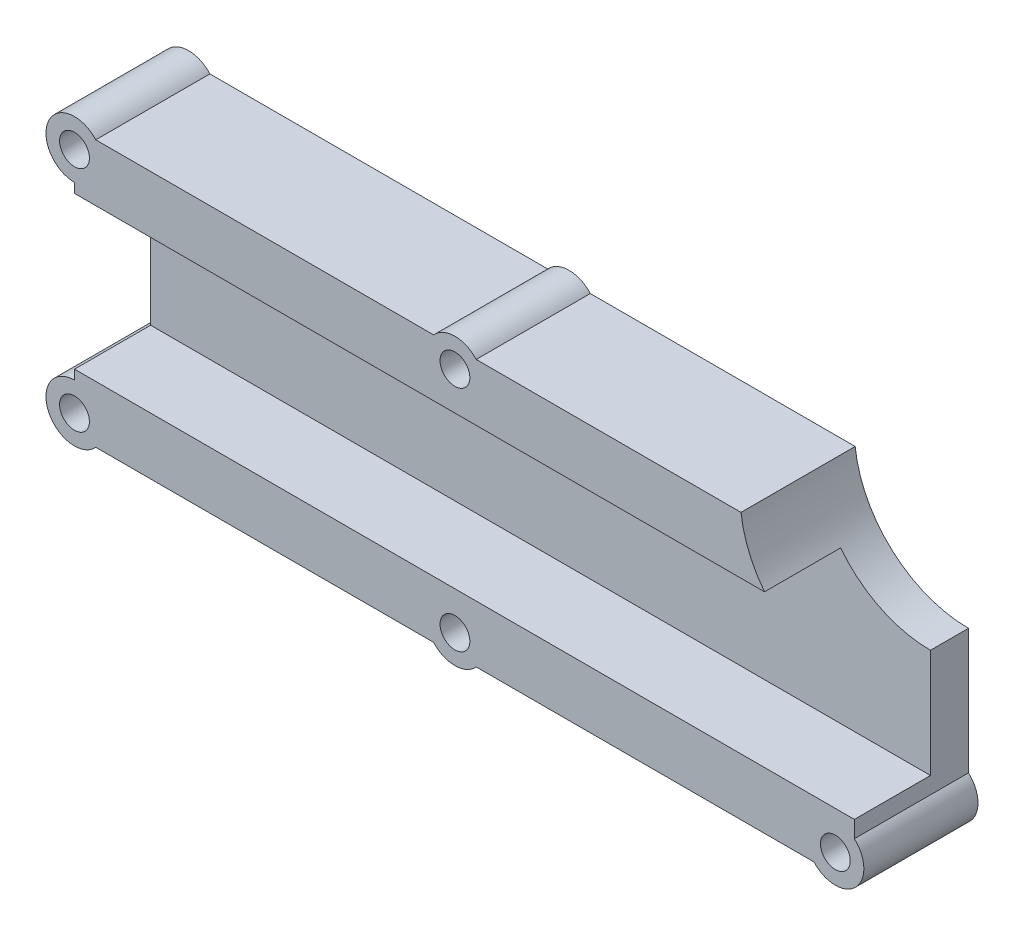
from build123d import *

# Parameters (mm, degrees)
SKETCH1_R           = 2.4892
BOSS_EXTRUDE1_DEPTH = 19.05
SKETCH2_W           = 12.7
SKETCH2_H           = 25.4
CUT_EXTRUDE1_DEPTH  = 140.862263719


with BuildPart() as part:
    # Sketch1 → Boss-Extrude1 (new body)
    # profile 1 of 2: a face of its own
    with BuildSketch(Plane.XY):
        with BuildLine():
            ThreePointArc((-3.549757914, -3.175), (0, -4.7625), (3.549757914, -3.175))
            Line((3.549757914, -3.175), (59.950242086, -3.175))
            ThreePointArc((59.950242086, -3.175), (66.867596045, -3.367596045), (66.675, 3.549757914))
            Line((66.675, 3.549757914), (66.675, 24.4475))
            ThreePointArc((66.675, 24.4475), (54.014749706, 29.263015025), (47.755090017, 41.275))
            Line((47.755090017, 41.275), (3.549757914, 41.275))
            Line((3.549757914, 41.275), (-3.549757914, 41.275))
            Line((-3.549757914, 41.275), (-59.950242086, 41.275))
            ThreePointArc((-59.950242086, 41.275), (-67.8475478, 40.044282483), (-63.5, 33.3375))
            Line((-63.5, 33.3375), (-63.5, 4.7625))
            ThreePointArc((-63.5, 4.7625), (-67.8475478, -1.944282483), (-59.950242086, -3.175))
            Line((-59.950242086, -3.175), (-3.549757914, -3.175))
        make_face()
        with Locations(Location((-63.5, 0, 0), (0, 0, 180))):
            Circle(SKETCH1_R, mode=Mode.SUBTRACT)
        with Locations(Location((0, 0, 0), (0, 0, 180))):
            Circle(SKETCH1_R, mode=Mode.SUBTRACT)
        with Locations(Location((63.5, 0, 0), (0, 0, 180))):
            Circle(SKETCH1_R, mode=Mode.SUBTRACT)
        with Locations(Location((-63.5, 38.1, 0), (0, 0, 180))):
            Circle(SKETCH1_R, mode=Mode.SUBTRACT)
        with Locations(Location((0, 38.1, 0), (0, 0, 180))):
            Circle(SKETCH1_R, mode=Mode.SUBTRACT)
    # profile 2 of 2: a face of its own
    with BuildSketch(Plane.XY):
        with BuildLine():
            Line((-3.549757914, 41.275), (3.549757914, 41.275))
            ThreePointArc((3.549757914, 41.275), (0, 42.8625), (-3.549757914, 41.275))
        make_face()
    extrude(amount=BOSS_EXTRUDE1_DEPTH)

    # Sketch2 → Cut-Extrude1 (cut, through all)
    with BuildSketch(Plane.ZY.offset(63.5)):
        with Locations((6.35, 19.05)):
            Rectangle(SKETCH2_W, SKETCH2_H)
    extrude(amount=-CUT_EXTRUDE1_DEPTH, mode=Mode.SUBTRACT)


with BuildPart() as body_2:
    # Mirror1: mirrored copy
    add(part.part.mirror(Plane.XY.offset(19.05)))


solid = body_2.part
